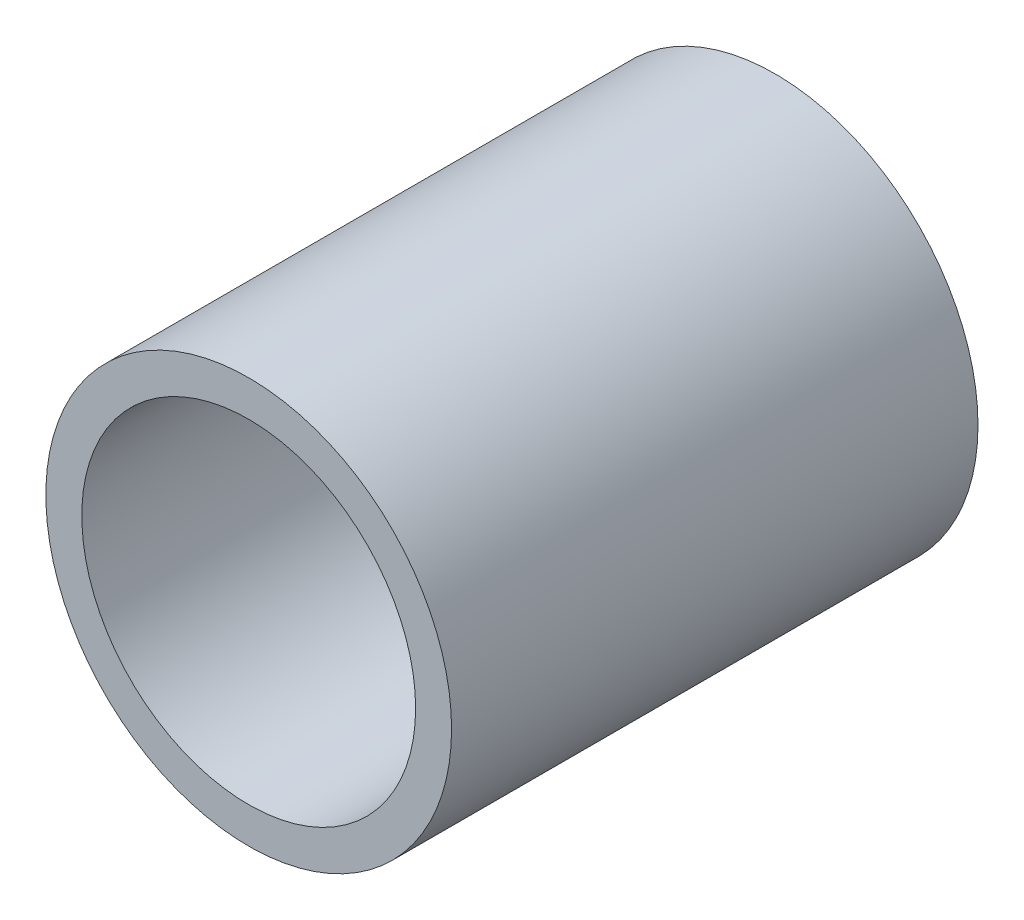
from build123d import *

# Parameters (mm, degrees)
SKETCH1_R           = 20.066
SKETCH1_R_2         = 16.51
BOSS_EXTRUDE1_DEPTH = 52.07


with BuildPart() as part:
    # Sketch1 → Boss-Extrude1 (new body)
    with BuildSketch(Plane.XY):
        Circle(SKETCH1_R)
        Circle(SKETCH1_R_2, mode=Mode.SUBTRACT)
    extrude(amount=BOSS_EXTRUDE1_DEPTH)


solid = part.part
